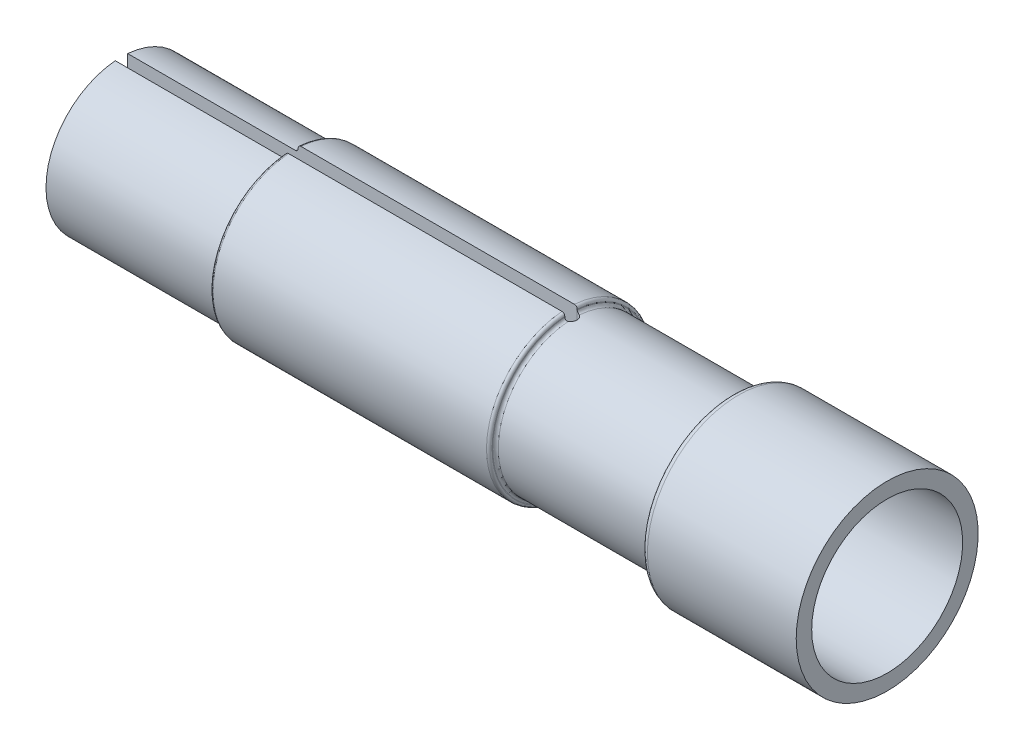
from build123d import *

# Parameters (mm, degrees)
CUT_EXTRUDE2_DEPTH = 16.27476517574002


with BuildPart() as part:
    # Sketch1 → Revolve1 (revolve)
    with BuildSketch(Plane(origin=(0, 0, 0), x_dir=(1, 0, 0), z_dir=(0, 1, 0)), mode=Mode.PRIVATE) as revolve1_sk:
        with BuildLine():
            Line((14.7, 2.4350000000000023), (10.2, 2.4350000000000014))
            Line((10.2, 2.4350000000000014), (10.2, 1.935))
            Line((10.2, 1.935), (4, 1.935))
            Line((4, 1.935), (4, 2.135))
            Line((4, 2.135), (-4, 2.135))
            Line((-4, 2.135), (-4, 1.935))
            Line((-4, 1.935), (-10, 1.9350000000000027))
            Line((-10, 1.9350000000000027), (-10, 2.435))
            Line((-10, 2.435), (-4.590000000000002, 2.435))
            ThreePointArc((-4.590000000000002, 2.435), (-4.526360389693211, 2.4613603896932106), (-4.500000000000001, 2.525000000000001))
            Line((-4.500000000000001, 2.525000000000001), (-4.500000000000001, 2.544999999999999))
            ThreePointArc((-4.500000000000001, 2.544999999999999), (-4.47363961030679, 2.6086396103067893), (-4.41, 2.635))
            Line((-4.41, 2.635), (4.41, 2.635))
            ThreePointArc((4.41, 2.635), (4.47363961030679, 2.6086396103067893), (4.500000000000001, 2.544999999999999))
            Line((4.500000000000001, 2.544999999999999), (4.500000000000001, 2.525000000000001))
            ThreePointArc((4.500000000000001, 2.525000000000001), (4.526360389693211, 2.4613603896932106), (4.590000000000002, 2.435))
            Line((4.590000000000002, 2.435), (9.499999999999996, 2.435))
            ThreePointArc((9.499999999999996, 2.435), (9.64142135623731, 2.4935786437626897), (9.7, 2.6350000000000016))
            Line((9.7, 2.6350000000000016), (9.7, 2.7350000000000008))
            ThreePointArc((9.7, 2.7350000000000008), (9.75857864376269, 2.8764213562373118), (9.9, 2.9350000000000023))
            Line((9.9, 2.9350000000000023), (14.7, 2.9350000000000023))
            Line((14.7, 2.9350000000000023), (14.7, 2.4350000000000023))
        make_face()
    revolve(revolve1_sk.sketch.rotate(Axis((-16.2, 0, 0), (1, 0, 0)), 180), axis=Axis((-16.2, 0, 0), (1, 0, 0)))

    # Sketch3 → Cut-Extrude2 (cut, through all)
    with BuildSketch(Plane(origin=(0, 0, 0), x_dir=(1, 0, 0), z_dir=(0, 1, 0))):
        with BuildLine():
            Line((-10, 0.20000000000000012), (4.500000000000001, 0.19999999999999996))
            ThreePointArc((4.500000000000001, 0.19999999999999996), (4.700000000000001, -5e-17), (4.500000000000001, -0.20000000000000007))
            Line((4.500000000000001, -0.20000000000000007), (-10, -0.20000000000000007))
            Line((-10, -0.20000000000000007), (-10, 0.20000000000000012))
        make_face()
    extrude(amount=CUT_EXTRUDE2_DEPTH, mode=Mode.SUBTRACT)


solid = part.part
